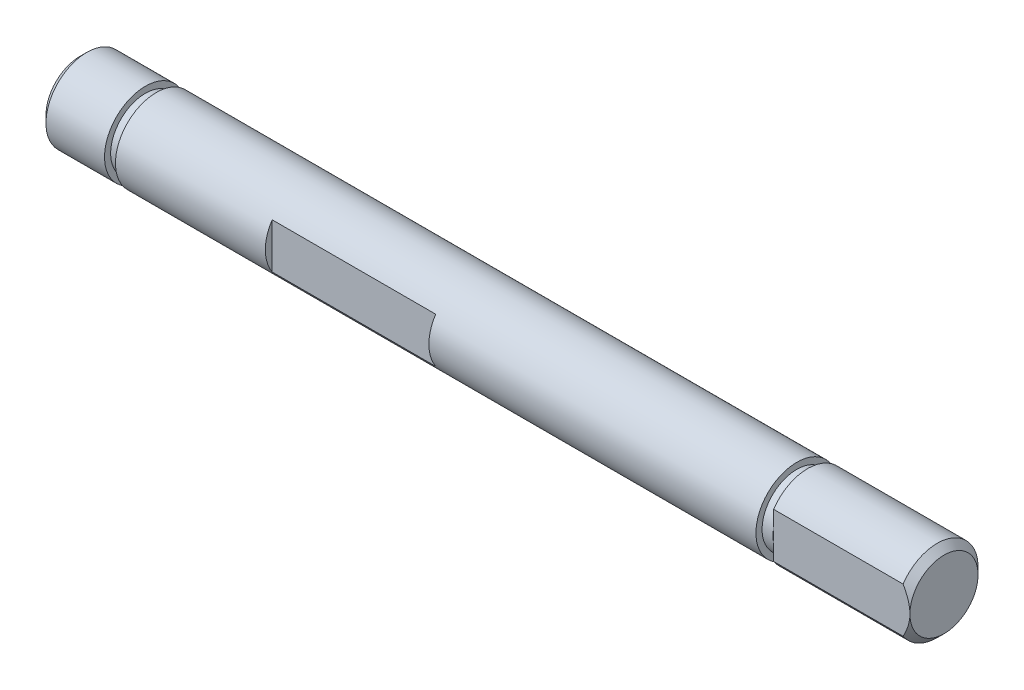
from build123d import *

# Parameters (mm, degrees)
CHAFL_N1_SIZE         = 0.5
CORTAR_EXTRUIR1_START = -10
CORTAR_EXTRUIR1_DEPTH = 10
CORTAR_EXTRUIR2_START = -46.8
CORTAR_EXTRUIR2_DEPTH = 12


with BuildPart() as part:
    # Croquis1 → Revolución1 (revolve)
    with BuildSketch(Plane(origin=(0, 0, 0), x_dir=(-1, 0, 0), z_dir=(0, 1, 0)), mode=Mode.PRIVATE) as revoluci_n1_sk:
        Polygon((-31.7, 0), (-31.7, 3), (-21.7, 3), (-21.7, 2.55), (-20.9, 2.55), (-20.9, 3), (26.1, 3), (26.1, 2.55), (26.9, 2.55), (26.9, 3), (31.7, 3), (31.7, 0), align=None)
    revolve(revoluci_n1_sk.sketch.rotate(Axis((31.7, 0, 0), (-1, 0, 0)), 180), axis=Axis((31.7, 0, 0), (-1, 0, 0)))

    # Chaflán1
    chafl_n1_edges = [part.edges().sort_by_distance(p)[0] for p in [
        (31.7, 0, 3),
        (-31.7, 0, 3),
    ]]
    chamfer(chafl_n1_edges, length=CHAFL_N1_SIZE)

    # Croquis2 → Cortar-Extruir1 (cut)
    with BuildSketch(Plane.YZ.offset(31.7).offset(CORTAR_EXTRUIR1_START)):
        with BuildLine():
            Line((1.658312395, 2.5), (-1.658312395, 2.5))
            ThreePointArc((-1.658312395, 2.5), (0, 3), (1.658312395, 2.5))
        make_face()
    extrude(amount=CORTAR_EXTRUIR1_DEPTH, mode=Mode.SUBTRACT)

    # Croquis2<2> → Cortar-Extruir2 (cut)
    with BuildSketch(Plane.YZ.offset(31.7).offset(CORTAR_EXTRUIR2_START)):
        with BuildLine():
            Line((1.658312395, 2.5), (-1.658312395, 2.5))
            ThreePointArc((-1.658312395, 2.5), (0, 3), (1.658312395, 2.5))
        make_face()
    extrude(amount=CORTAR_EXTRUIR2_DEPTH, mode=Mode.SUBTRACT)


solid = part.part
